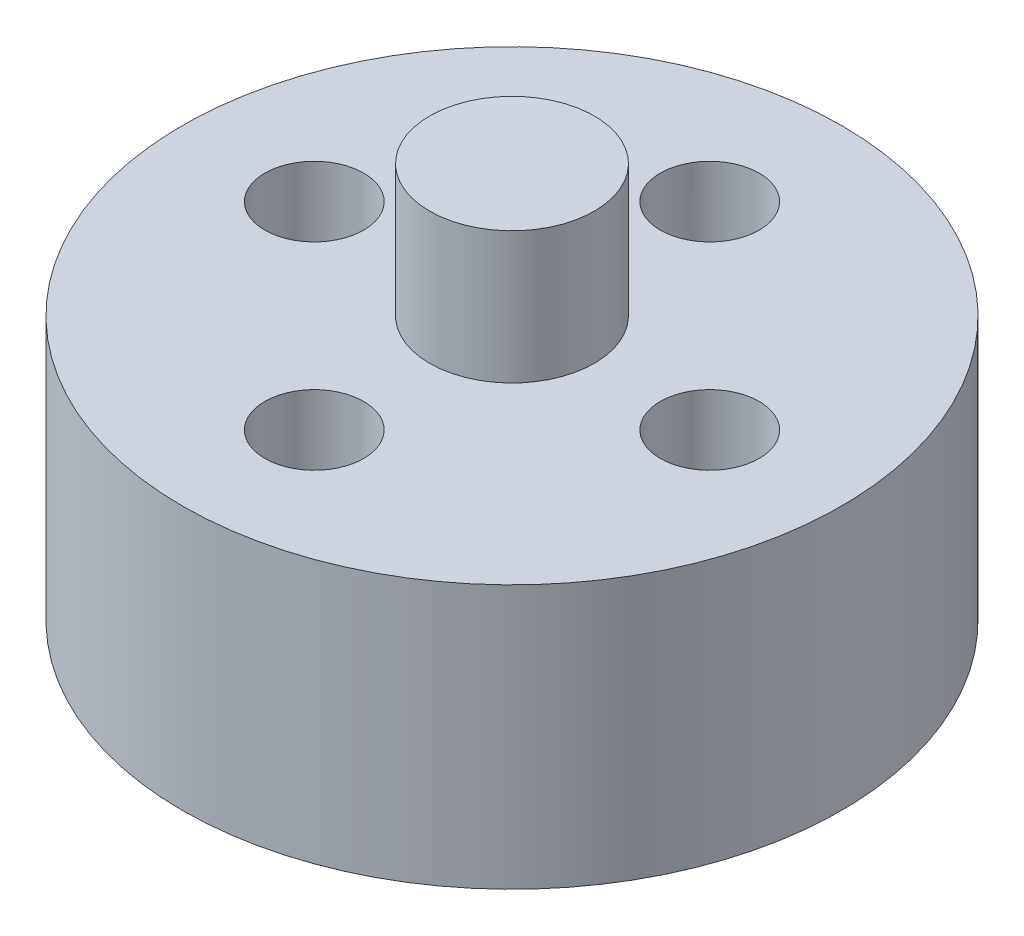
from build123d import *

# Parameters (mm, degrees)
SKETCH1_R               = 10
BOSS_EXTRUDE1_DEPTH     = 7
SKETCH2_R               = 10
BOSS_EXTRUDE2_DEPTH     = 1
SKETCH3_R               = 2.5
BOSS_EXTRUDE3_DEPTH     = 4
SKETCH4_R               = 1.5
CUT_EXTRUDE1_DEPTH      = 4
CUT_EXTRUDE2_DEPTH      = 2
CUT_EXTRUDE2_DEPTH_BACK = 20.397164741
SKETCH5_R               = 1.4


with BuildPart() as part:
    # Sketch1 → Boss-Extrude1 (new body)
    with BuildSketch(Plane(origin=(0, 0, 0), x_dir=(1, 0, 0), z_dir=(0, 1, 0))):
        Circle(SKETCH1_R)
        with BuildLine():
            Line((-1.322875656, 1.5), (1.322875656, 1.5))
            ThreePointArc((1.322875656, 1.5), (0, -2), (-1.322875656, 1.5))
        make_face(mode=Mode.SUBTRACT)
    extrude(amount=BOSS_EXTRUDE1_DEPTH)

    # Sketch2 → Boss-Extrude2 (add)
    with BuildSketch(Plane(origin=(0, 7, 0), x_dir=(1, 0, 0), z_dir=(0, 1, 0))):
        Circle(SKETCH2_R)
    extrude(amount=BOSS_EXTRUDE2_DEPTH)

    # Sketch3 → Boss-Extrude3 (add)
    with BuildSketch(Plane(origin=(0, 8, 0), x_dir=(1, 0, 0), z_dir=(0, 1, 0))):
        Circle(SKETCH3_R)
    extrude(amount=BOSS_EXTRUDE3_DEPTH)

    # Sketch4 → Cut-Extrude1 (cut)
    with BuildSketch(Plane(origin=(0, 8, 0), x_dir=(1, 0, 0), z_dir=(0, 1, 0))):
        with Locations((6, 0)):
            Circle(SKETCH4_R)
        with Locations((0, -6)):
            Circle(SKETCH4_R)
        with Locations((-6, 0)):
            Circle(SKETCH4_R)
        with Locations((0, 6)):
            Circle(SKETCH4_R)
    extrude(amount=-CUT_EXTRUDE1_DEPTH, mode=Mode.SUBTRACT)

    # Sketch5 → Cut-Extrude2 (cut, two sides: drawn at the far end of the back side and taken through both)
    with BuildSketch(Plane.XY.offset(-1.5).offset(-CUT_EXTRUDE2_DEPTH_BACK)):
        with Locations((0, 3)):
            Circle(SKETCH5_R)
    extrude(amount=CUT_EXTRUDE2_DEPTH + CUT_EXTRUDE2_DEPTH_BACK, mode=Mode.SUBTRACT)


solid = part.part
